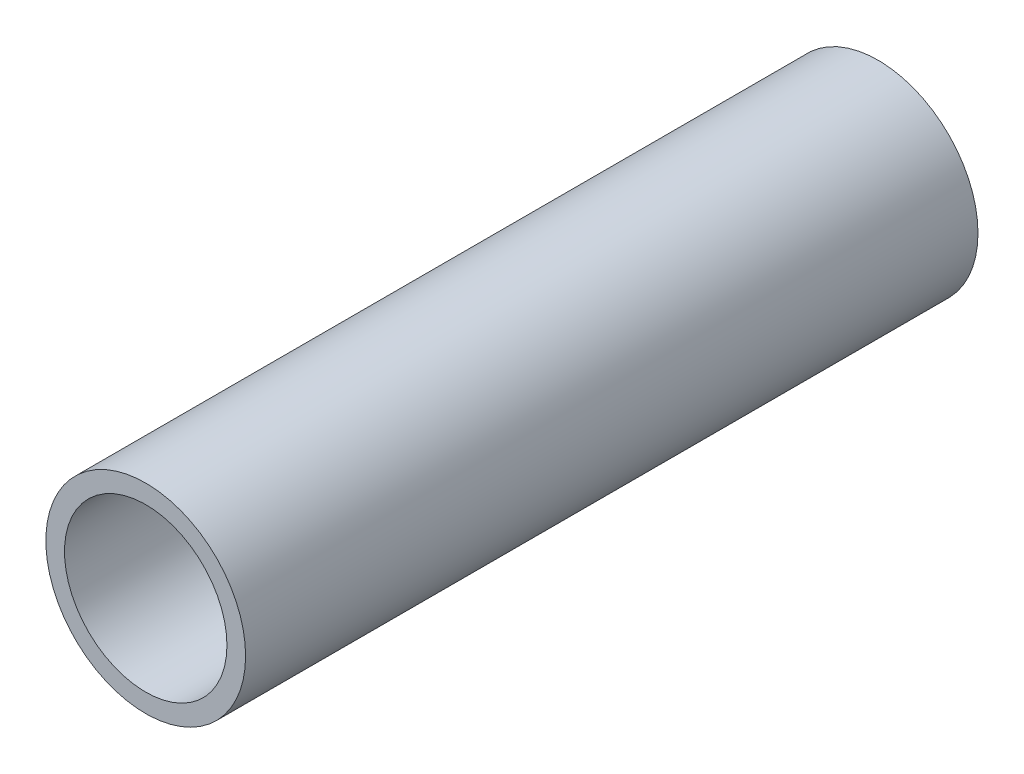
from build123d import *

# Parameters (mm, degrees)
SKETCH_1_W          = 1.4
SKETCH_1_H          = 200
CUT_EXTRUDE_START   = -145
SKETCH_2_R          = 7.5
CUT_EXTRUDE_1_DEPTH = 145


with BuildPart() as part:
    # 스케치1 → 회전1 (revolve)
    with BuildSketch(Plane(origin=(0, 0, 0), x_dir=(1, 0, 0), z_dir=(0, 1, 0))):
        with Locations((6.8, -100)):
            Rectangle(SKETCH_1_W, SKETCH_1_H)
    revolve(axis=Axis((0, 0, 0), (0, 0, 1)))

    # 스케치2 → 컷-돌출1 (cut)
    with BuildSketch(Plane.XY.offset(200).offset(CUT_EXTRUDE_START)):
        Circle(SKETCH_2_R)
    extrude(amount=CUT_EXTRUDE_1_DEPTH, mode=Mode.SUBTRACT)


solid = part.part
